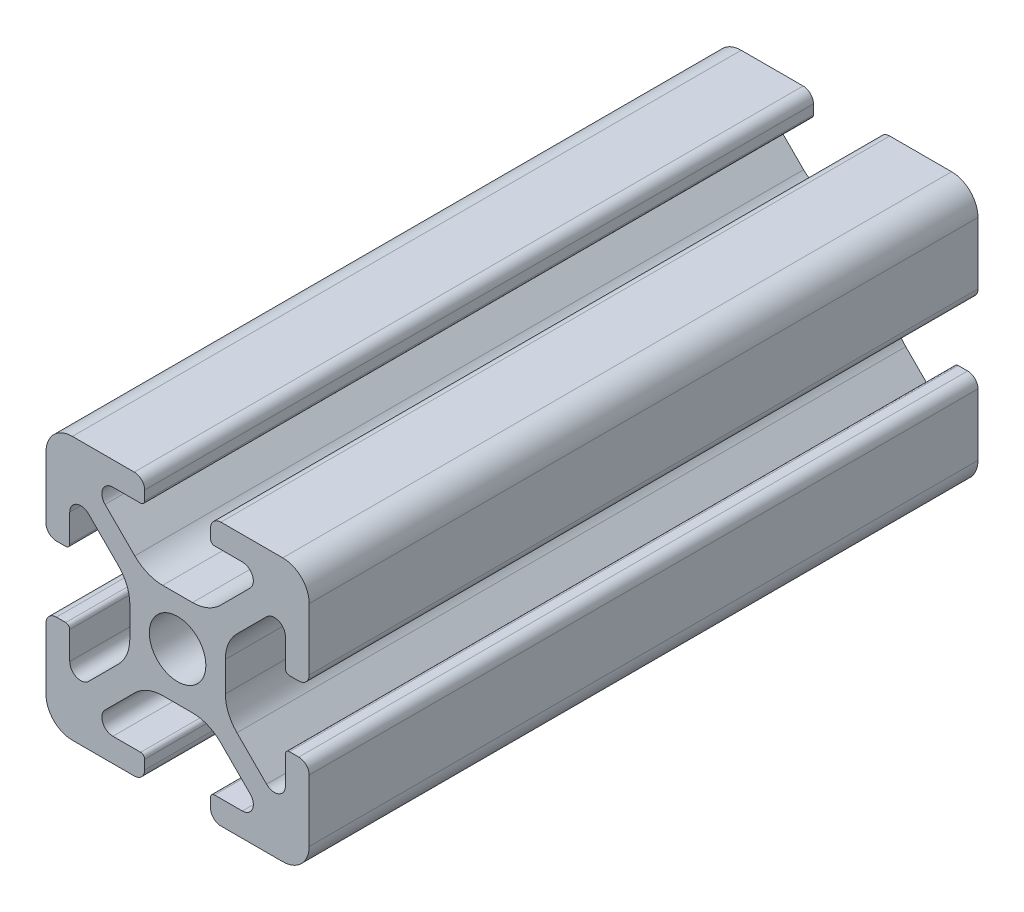
from build123d import *

# Parameters (mm, degrees)
SKETCH1_R           = 2.1463
BOSS_EXTRUDE1_DEPTH = 25.4


with BuildPart() as part:
    # Sketch1 → Boss-Extrude1 (new, symmetric)
    with BuildSketch(Plane.XY):
        with BuildLine():
            Line((-9.9949, 7.9883), (-9.9949, 3.2893))
            ThreePointArc((-9.9949, 3.2893), (-9.76427588, 2.73252412), (-9.2075, 2.5019))
            Line((-9.2075, 2.5019), (-8.4963, 2.5019))
            ThreePointArc((-8.4963, 2.5019), (-8.280773853, 2.591173853), (-8.1915, 2.8067))
            Line((-8.1915, 2.8067), (-8.1915, 4.9149))
            ThreePointArc((-8.1915, 4.9149), (-7.674065253, 5.689295824), (-6.760603096, 5.507596904))
            Line((-6.760603096, 5.507596904), (-4.505765747, 3.252759555))
            ThreePointArc((-4.505765747, 3.252759555), (-3.856054457, 2.280397894), (-3.627906192, 1.133419111))
            Line((-3.627906192, 1.133419111), (-3.627906192, -1.133419111))
            ThreePointArc((-3.627906192, -1.133419111), (-3.856054457, -2.280397894), (-4.505765747, -3.252759555))
            Line((-4.505765747, -3.252759555), (-6.760603096, -5.507596904))
            ThreePointArc((-6.760603096, -5.507596904), (-7.674065253, -5.689295824), (-8.1915, -4.9149))
            Line((-8.1915, -4.9149), (-8.1915, -2.8067))
            ThreePointArc((-8.1915, -2.8067), (-8.280773853, -2.591173853), (-8.4963, -2.5019))
            Line((-8.4963, -2.5019), (-9.2075, -2.5019))
            ThreePointArc((-9.2075, -2.5019), (-9.76427588, -2.73252412), (-9.9949, -3.2893))
            Line((-9.9949, -3.2893), (-9.9949, -7.9883))
            ThreePointArc((-9.9949, -7.9883), (-9.407180467, -9.407180467), (-7.9883, -9.9949))
            Line((-7.9883, -9.9949), (-3.2893, -9.9949))
            ThreePointArc((-3.2893, -9.9949), (-2.73252412, -9.76427588), (-2.5019, -9.2075))
            Line((-2.5019, -9.2075), (-2.5019, -8.4963))
            ThreePointArc((-2.5019, -8.4963), (-2.591173853, -8.280773853), (-2.8067, -8.1915))
            Line((-2.8067, -8.1915), (-4.9149, -8.1915))
            ThreePointArc((-4.9149, -8.1915), (-5.689295824, -7.674065253), (-5.507596904, -6.760603096))
            Line((-5.507596904, -6.760603096), (-3.252759555, -4.505765747))
            ThreePointArc((-3.252759555, -4.505765747), (-2.280397894, -3.856054457), (-1.133419111, -3.627906192))
            Line((-1.133419111, -3.627906192), (1.133419111, -3.627906192))
            ThreePointArc((1.133419111, -3.627906192), (2.280397894, -3.856054457), (3.252759555, -4.505765747))
            Line((3.252759555, -4.505765747), (5.507596904, -6.760603096))
            ThreePointArc((5.507596904, -6.760603096), (5.689295824, -7.674065253), (4.9149, -8.1915))
            Line((4.9149, -8.1915), (2.8067, -8.1915))
            ThreePointArc((2.8067, -8.1915), (2.591173853, -8.280773853), (2.5019, -8.4963))
            Line((2.5019, -8.4963), (2.5019, -9.2075))
            ThreePointArc((2.5019, -9.2075), (2.73252412, -9.76427588), (3.2893, -9.9949))
            Line((3.2893, -9.9949), (7.9883, -9.9949))
            ThreePointArc((7.9883, -9.9949), (9.407180467, -9.407180467), (9.9949, -7.9883))
            Line((9.9949, -7.9883), (9.9949, -3.2893))
            ThreePointArc((9.9949, -3.2893), (9.76427588, -2.73252412), (9.2075, -2.5019))
            Line((9.2075, -2.5019), (8.4963, -2.5019))
            ThreePointArc((8.4963, -2.5019), (8.280773853, -2.591173853), (8.1915, -2.8067))
            Line((8.1915, -2.8067), (8.1915, -4.9149))
            ThreePointArc((8.1915, -4.9149), (7.674065253, -5.689295824), (6.760603096, -5.507596904))
            Line((6.760603096, -5.507596904), (4.505765747, -3.252759555))
            ThreePointArc((4.505765747, -3.252759555), (3.856054457, -2.280397894), (3.627906192, -1.133419111))
            Line((3.627906192, -1.133419111), (3.627906192, 1.133419111))
            ThreePointArc((3.627906192, 1.133419111), (3.856054457, 2.280397894), (4.505765747, 3.252759555))
            Line((4.505765747, 3.252759555), (6.760603096, 5.507596904))
            ThreePointArc((6.760603096, 5.507596904), (7.674065253, 5.689295824), (8.1915, 4.9149))
            Line((8.1915, 4.9149), (8.1915, 2.8067))
            ThreePointArc((8.1915, 2.8067), (8.280773853, 2.591173853), (8.4963, 2.5019))
            Line((8.4963, 2.5019), (9.2075, 2.5019))
            ThreePointArc((9.2075, 2.5019), (9.76427588, 2.73252412), (9.9949, 3.2893))
            Line((9.9949, 3.2893), (9.9949, 7.9883))
            ThreePointArc((9.9949, 7.9883), (9.407180467, 9.407180467), (7.9883, 9.9949))
            Line((7.9883, 9.9949), (3.2893, 9.9949))
            ThreePointArc((3.2893, 9.9949), (2.73252412, 9.76427588), (2.5019, 9.2075))
            Line((2.5019, 9.2075), (2.5019, 8.4963))
            ThreePointArc((2.5019, 8.4963), (2.591173853, 8.280773853), (2.8067, 8.1915))
            Line((2.8067, 8.1915), (4.9149, 8.1915))
            ThreePointArc((4.9149, 8.1915), (5.689295824, 7.674065253), (5.507596904, 6.760603096))
            Line((5.507596904, 6.760603096), (3.252759555, 4.505765747))
            ThreePointArc((3.252759555, 4.505765747), (2.280397894, 3.856054457), (1.133419111, 3.627906192))
            Line((1.133419111, 3.627906192), (-1.133419111, 3.627906192))
            ThreePointArc((-1.133419111, 3.627906192), (-2.280397894, 3.856054457), (-3.252759555, 4.505765747))
            Line((-3.252759555, 4.505765747), (-5.507596904, 6.760603096))
            ThreePointArc((-5.507596904, 6.760603096), (-5.689295824, 7.674065253), (-4.9149, 8.1915))
            Line((-4.9149, 8.1915), (-2.8067, 8.1915))
            ThreePointArc((-2.8067, 8.1915), (-2.591173853, 8.280773853), (-2.5019, 8.4963))
            Line((-2.5019, 8.4963), (-2.5019, 9.2075))
            ThreePointArc((-2.5019, 9.2075), (-2.73252412, 9.76427588), (-3.2893, 9.9949))
            Line((-3.2893, 9.9949), (-7.9883, 9.9949))
            ThreePointArc((-7.9883, 9.9949), (-9.407180467, 9.407180467), (-9.9949, 7.9883))
        make_face()
        Circle(SKETCH1_R, mode=Mode.SUBTRACT)
    extrude(amount=BOSS_EXTRUDE1_DEPTH, both=True)


solid = part.part
